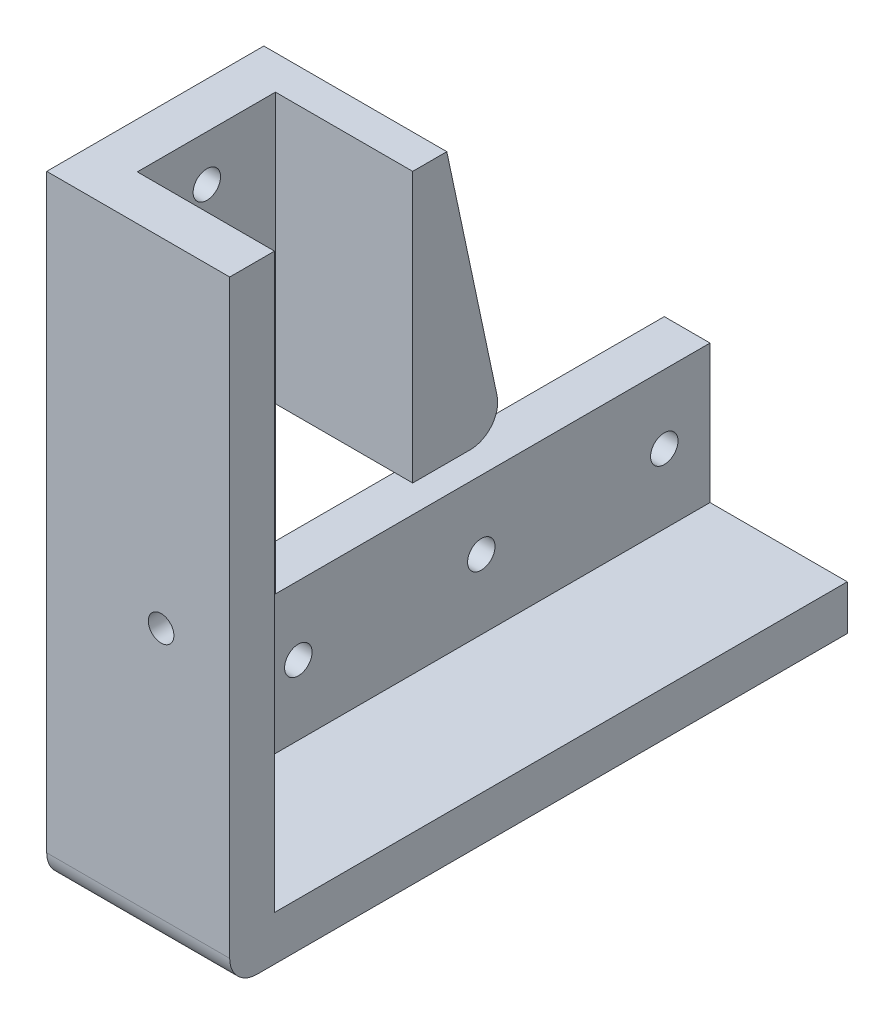
from build123d import *

# Parameters (mm, degrees)
SKETCH_1_R          = 1.5
EXTRUDE_1_DEPTH     = 20
CUT_EXTRUDE_1_DEPTH = 15
SKETCH_3_R          = 1.4
CUT_EXTRUDE_2_DEPTH = 86.695740851
FILLET_1_R          = 3


with BuildPart() as part:
    # 草图1 → 凸台-拉伸1 (new body)
    with BuildSketch(Plane(origin=(0, 0, 0), x_dir=(0, 0, -1), z_dir=(1, 0, 0))):
        Polygon((-12.5, -12.5), (55, -12.5), (55, 7.5), (7.5, 7.5), (7.5, 25.5), (17.5, 25.5), (11.229581431, 55), (-12.5, 55), align=None)
        with Locations((0, 10)):
            Circle(SKETCH_1_R, mode=Mode.SUBTRACT)
        with Locations((0, 30)):
            Circle(SKETCH_1_R, mode=Mode.SUBTRACT)
        with Locations((10, 0)):
            Circle(SKETCH_1_R, mode=Mode.SUBTRACT)
        with Locations((30, 0)):
            Circle(SKETCH_1_R, mode=Mode.SUBTRACT)
        with Locations((50, 0)):
            Circle(SKETCH_1_R, mode=Mode.SUBTRACT)
        with Locations((0, 50)):
            Circle(SKETCH_1_R, mode=Mode.SUBTRACT)
    extrude(amount=EXTRUDE_1_DEPTH)

    # 草图2 → 切除-拉伸1 (cut)
    with BuildSketch(Plane.ZY.offset(-20)):
        Polygon((7.6, 55), (7.6, -7.6), (-55, -7.6), (-55, 7.5), (-7.5, 7.5), (-7.5, 55), align=None)
    extrude(amount=CUT_EXTRUDE_1_DEPTH, mode=Mode.SUBTRACT)

    # 草图3 → 切除-拉伸2 (cut, through all)
    with BuildSketch(Plane(origin=(0, 0, 7.6), x_dir=(-1, 0, 0), z_dir=(0, 0, -1))):
        with Locations(Location((-12.5, 18, 0), (0, 0, 90))):
            Circle(SKETCH_3_R)
    extrude(amount=-CUT_EXTRUDE_2_DEPTH, mode=Mode.SUBTRACT)

    # 圆角1
    fillet_1_edges = [part.edges().sort_by_distance(p)[0] for p in [
        (10, -12.5, 12.5),
        (10, 25.5, -17.5),
    ]]
    fillet(fillet_1_edges, radius=FILLET_1_R)


solid = part.part
